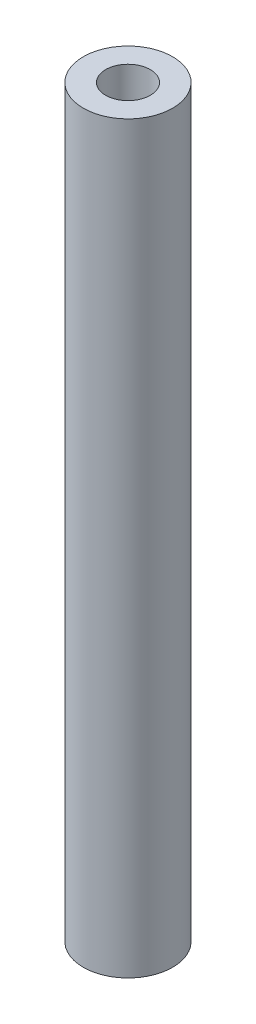
from build123d import *

# Parameters (mm, degrees)
SKETCH_1_R      = 3
SKETCH_1_R_2    = 1.5
EXTRUDE_1_DEPTH = 50


with BuildPart() as part:
    # 草图1 → 凸台-拉伸1 (new body)
    with BuildSketch(Plane(origin=(0, 0, 0), x_dir=(1, 0, 0), z_dir=(0, 1, 0))):
        with Locations(Location((0, 0, 0), (0, 0, 270))):
            Circle(SKETCH_1_R)
        with Locations(Location((0, 0, 0), (0, 0, 270))):
            Circle(SKETCH_1_R_2, mode=Mode.SUBTRACT)
    extrude(amount=EXTRUDE_1_DEPTH)


solid = part.part
